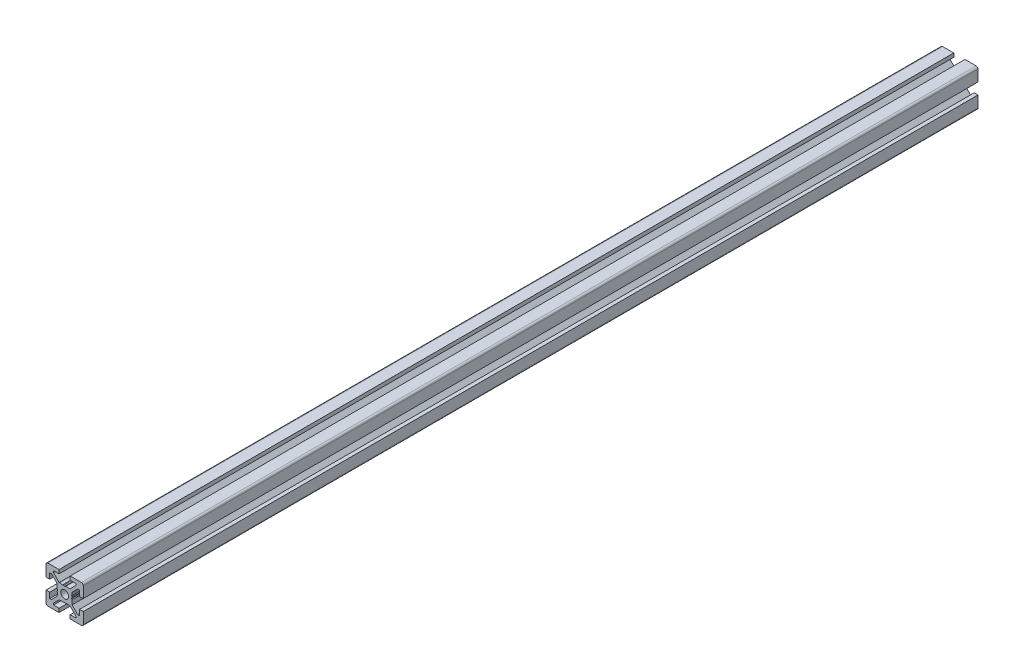
from build123d import *

# Parameters (mm, degrees)
SKETCH1_R           = 2.1
BOSS_EXTRUDE1_DEPTH = 480


with BuildPart() as part:
    # Sketch1 → Boss-Extrude1 (new body)
    with BuildSketch(Plane(origin=(0, 0, -2000), x_dir=(-1, 0, 0), z_dir=(0, 0, -1))):
        with BuildLine():
            Line((10, -3), (8, -3))
            Line((8, -3), (8, -6))
            Line((8, -6), (7.060660172, -6))
            Line((7.060660172, -6), (4, -2.939339828))
            Line((4, -2.939339828), (4, -2.5))
            Line((4, -2.5), (3.750976592, -1.218885629))
            Line((3.750976592, -1.218885629), (3.933012702, -0.903589838))
            ThreePointArc((3.933012702, -0.903589838), (4, -0.653589838), (3.933012702, -0.403589838))
            Line((3.933012702, -0.403589838), (3.7, 0))
            Line((3.7, 0), (3.933012702, 0.403589838))
            ThreePointArc((3.933012702, 0.403589838), (3.982962913, 0.524180316), (4, 0.653589838))
            Line((4, 0.653589838), (4, 2.939339828))
            Line((4, 2.939339828), (7.060660172, 6))
            Line((7.060660172, 6), (8, 6))
            Line((8, 6), (8, 3))
            Line((8, 3), (10, 3))
            Line((10, 3), (10, 9))
            ThreePointArc((10, 9), (9.707106781, 9.707106781), (9, 10))
            Line((9, 10), (3, 10))
            Line((3, 10), (3, 8))
            Line((3, 8), (6, 8))
            Line((6, 8), (6, 7.060660172))
            Line((6, 7.060660172), (2.939339828, 4))
            Line((2.939339828, 4), (2.5, 4))
            Line((2.5, 4), (1.218885629, 3.750976592))
            Line((1.218885629, 3.750976592), (0.903589838, 3.933012702))
            ThreePointArc((0.903589838, 3.933012702), (0.653589838, 4), (0.403589838, 3.933012702))
            Line((0.403589838, 3.933012702), (0, 3.7))
            Line((0, 3.7), (-0.403589838, 3.933012702))
            ThreePointArc((-0.403589838, 3.933012702), (-0.524180316, 3.982962913), (-0.653589838, 4))
            Line((-0.653589838, 4), (-2.939339828, 4))
            Line((-2.939339828, 4), (-6, 7.060660172))
            Line((-6, 7.060660172), (-6, 8))
            Line((-6, 8), (-3, 8))
            Line((-3, 8), (-3, 10))
            Line((-3, 10), (-9, 10))
            ThreePointArc((-9, 10), (-9.707106781, 9.707106781), (-10, 9))
            Line((-10, 9), (-10, 3))
            Line((-10, 3), (-8, 3))
            Line((-8, 3), (-8, 6))
            Line((-8, 6), (-7.060660172, 6))
            Line((-7.060660172, 6), (-4, 2.939339828))
            Line((-4, 2.939339828), (-4, 2.5))
            Line((-4, 2.5), (-3.750976592, 1.218885629))
            Line((-3.750976592, 1.218885629), (-3.933012702, 0.903589838))
            ThreePointArc((-3.933012702, 0.903589838), (-4, 0.653589838), (-3.933012702, 0.403589838))
            Line((-3.933012702, 0.403589838), (-3.7, 0))
            Line((-3.7, 0), (-3.933012702, -0.403589838))
            ThreePointArc((-3.933012702, -0.403589838), (-3.982962913, -0.524180316), (-4, -0.653589838))
            Line((-4, -0.653589838), (-4, -2.939339828))
            Line((-4, -2.939339828), (-7.060660172, -6))
            Line((-7.060660172, -6), (-8, -6))
            Line((-8, -6), (-8, -3))
            Line((-8, -3), (-10, -3))
            Line((-10, -3), (-10, -9))
            ThreePointArc((-10, -9), (-9.707106781, -9.707106781), (-9, -10))
            Line((-9, -10), (-3, -10))
            Line((-3, -10), (-3, -8))
            Line((-3, -8), (-6, -8))
            Line((-6, -8), (-6, -7.060660172))
            Line((-6, -7.060660172), (-2.939339828, -4))
            Line((-2.939339828, -4), (-2.5, -4))
            Line((-2.5, -4), (-1.218885629, -3.750976592))
            Line((-1.218885629, -3.750976592), (-0.903589838, -3.933012702))
            ThreePointArc((-0.903589838, -3.933012702), (-0.653589838, -4), (-0.403589838, -3.933012702))
            Line((-0.403589838, -3.933012702), (0, -3.7))
            Line((0, -3.7), (0.403589838, -3.933012702))
            ThreePointArc((0.403589838, -3.933012702), (0.524180316, -3.982962913), (0.653589838, -4))
            Line((0.653589838, -4), (2.939339828, -4))
            Line((2.939339828, -4), (6, -7.060660172))
            Line((6, -7.060660172), (6, -8))
            Line((6, -8), (3, -8))
            Line((3, -8), (3, -10))
            Line((3, -10), (9, -10))
            ThreePointArc((9, -10), (9.707106781, -9.707106781), (10, -9))
            Line((10, -9), (10, -3))
        make_face()
        with Locations(Location((0, 0, 0), (0, 0, 180))):
            Circle(SKETCH1_R, mode=Mode.SUBTRACT)
    extrude(amount=-BOSS_EXTRUDE1_DEPTH)


solid = part.part
